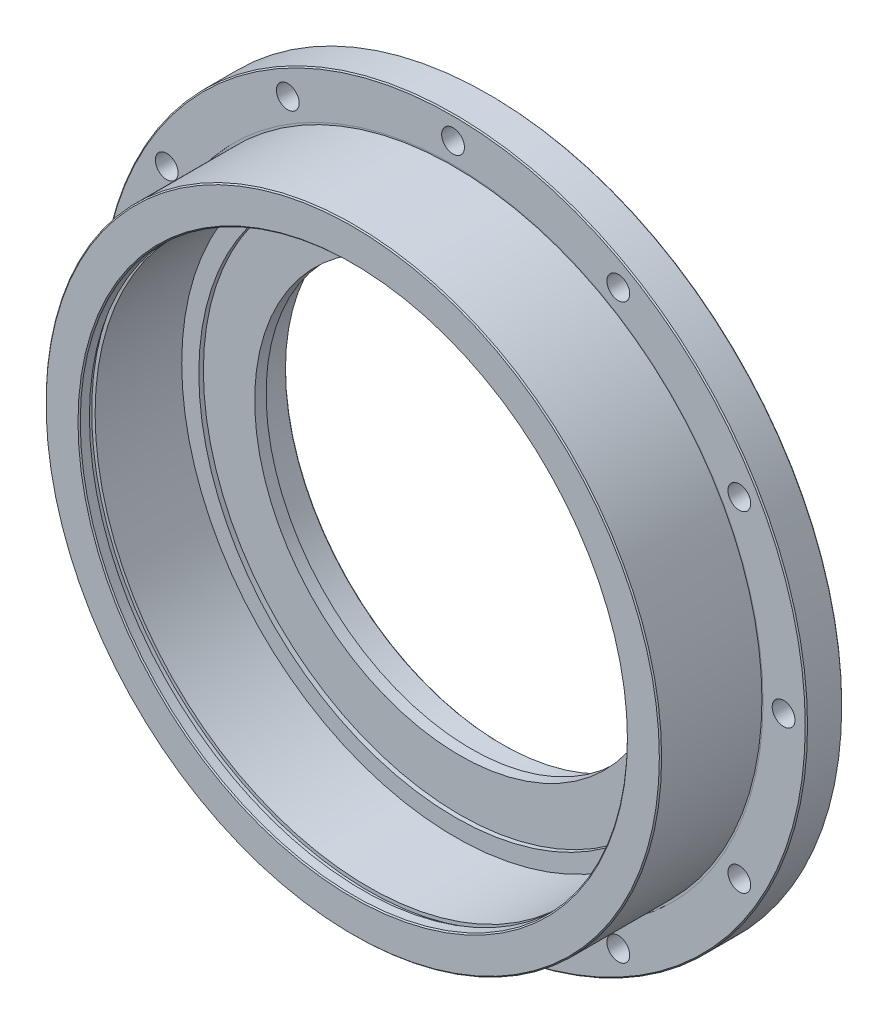
from build123d import *

# Parameters (mm, degrees)
SKETCH_1_R          = 155
EXTRUDE_1_DEPTH     = 20
SKETCH_2_R          = 135
EXTRUDE_2_DEPTH     = 40
SKETCH_3_R          = 120
CUT_EXTRUDE_1_DEPTH = 228.266363547
SKETCH_4_R          = 120
SKETCH_4_R_2        = 112.5
EXTRUDE_3_DEPTH     = 15
SKETCH_5_R          = 121.5
SKETCH_5_R_2        = 120
CUT_EXTRUDE_2_DEPTH = 2.5
SKETCH_7_R          = 5
CUT_EXTRUDE_3_DEPTH = 25
SKETCH_9_R          = 120
CUT_EXTRUDE_4_DEPTH = 13
EXTRUDE_START       = 19
SKETCH_10_R         = 120
SKETCH_10_R_2       = 95
EXTRUDE_4_DEPTH     = 19
EXTRUDE_START_2     = -5
SKETCH_12_R         = 95
SKETCH_12_R_2       = 90
EXTRUDE_5_DEPTH     = 5
CUT_EXTRUDE_START   = -4
SKETCH_13_R         = 155
SKETCH_13_R_2       = 135
CUT_EXTRUDE_5_DEPTH = 4
CHAMFER_1_SIZE      = 0.5
SKETCH_14_W         = 1
SKETCH_14_H         = 0.5


with BuildPart() as part:
    # 草图1 → 拉伸1 (new body)
    with BuildSketch(Plane.XY):
        Circle(SKETCH_1_R)
    extrude(amount=EXTRUDE_1_DEPTH)

    # 草图2 → 拉伸2 (add)
    with BuildSketch(Plane.XY.offset(20)):
        Circle(SKETCH_2_R)
    extrude(amount=EXTRUDE_2_DEPTH)

    # 草图3 → 切除-拉伸1 (cut, through all)
    with BuildSketch(Plane(origin=(0, 0, 0), x_dir=(-1, 0, 0), z_dir=(0, 0, -1))):
        Circle(SKETCH_3_R)
    extrude(amount=-CUT_EXTRUDE_1_DEPTH, mode=Mode.SUBTRACT)

    # 草图4 → 拉伸3 (add)
    with BuildSketch(Plane(origin=(0, 0, 0), x_dir=(-1, 0, 0), z_dir=(0, 0, -1))):
        Circle(SKETCH_4_R)
        Circle(SKETCH_4_R_2, mode=Mode.SUBTRACT)
    extrude(amount=-EXTRUDE_3_DEPTH)

    # 草图5 → 切除-拉伸2 (cut)
    with BuildSketch(Plane.XY.offset(53)):
        Circle(SKETCH_5_R)
        with Locations(Location((0, 0, 0), (0, 0, 180))):
            Circle(SKETCH_5_R_2, mode=Mode.SUBTRACT)
    extrude(amount=CUT_EXTRUDE_2_DEPTH, mode=Mode.SUBTRACT)

    # 草图7 → 切除-拉伸3 (cut)
    with BuildSketch(Plane.XY.offset(20)):
        with Locations((72.5, 125.573683549)):
            Circle(SKETCH_7_R)
        with Locations((0, 145)):
            Circle(SKETCH_7_R)
        with Locations((125.573683549, 72.5)):
            Circle(SKETCH_7_R)
        with Locations((145, 0)):
            Circle(SKETCH_7_R)
        with Locations((125.573683549, -72.5)):
            Circle(SKETCH_7_R)
        with Locations((72.5, -125.573683549)):
            Circle(SKETCH_7_R)
        with Locations((0, -145)):
            Circle(SKETCH_7_R)
        with Locations((-72.5, -125.573683549)):
            Circle(SKETCH_7_R)
        with Locations((-125.573683549, -72.5)):
            Circle(SKETCH_7_R)
        with Locations((-145, 0)):
            Circle(SKETCH_7_R)
        with Locations((-125.573683549, 72.5)):
            Circle(SKETCH_7_R)
        with Locations((-72.5, 125.573683549)):
            Circle(SKETCH_7_R)
    extrude(amount=-CUT_EXTRUDE_3_DEPTH, mode=Mode.SUBTRACT)

    # 草图9 → 切除-拉伸4 (cut)
    with BuildSketch(Plane(origin=(0, 0, 0), x_dir=(-1, 0, 0), z_dir=(0, 0, -1))):
        Circle(SKETCH_9_R)
    extrude(amount=-CUT_EXTRUDE_4_DEPTH, mode=Mode.SUBTRACT)

    # 草图10 → 拉伸4 (add)
    with BuildSketch(Plane(origin=(0, 0, 13), x_dir=(-1, 0, 0), z_dir=(0, 0, -1)).offset(EXTRUDE_START)):
        Circle(SKETCH_10_R)
        Circle(SKETCH_10_R_2, mode=Mode.SUBTRACT)
    extrude(amount=-EXTRUDE_4_DEPTH)

    # 草图12 → 拉伸5 (add)
    with BuildSketch(Plane.XY.offset(13).offset(EXTRUDE_START_2)):
        Circle(SKETCH_12_R)
        Circle(SKETCH_12_R_2, mode=Mode.SUBTRACT)
    extrude(amount=EXTRUDE_5_DEPTH)

    # 草图13 → 切除-拉伸5 (cut)
    with BuildSketch(Plane.XY.offset(20).offset(CUT_EXTRUDE_START)):
        Circle(SKETCH_13_R)
        Circle(SKETCH_13_R_2, mode=Mode.SUBTRACT)
    extrude(amount=CUT_EXTRUDE_5_DEPTH, mode=Mode.SUBTRACT)

    # 倒角1
    chamfer_1_edges = [part.edges().sort_by_distance(p)[0] for p in [
        (120, 0, 60),
        (-155, 0, 16),
        (-155, 0, 0),
        (-135, 0, 60),
        (120, 0, -6),
        (95, 0, -6),
    ]]
    chamfer(chamfer_1_edges, length=CHAMFER_1_SIZE)

    # 草图14 → 切除-旋转1 (revolve, cut)
    with BuildSketch(Plane(origin=(0, 0, 0), x_dir=(1, 0, 0), z_dir=(0, 1, 0)), mode=Mode.PRIVATE) as cut_revolve_1_sk:
        with Locations((-135.5, -15.75)):
            Rectangle(SKETCH_14_W, SKETCH_14_H)
    revolve(cut_revolve_1_sk.sketch.rotate(Axis((0, 0, 8), (0, 0, -1)), 180), axis=Axis((0, 0, 8), (0, 0, -1)), mode=Mode.SUBTRACT)


solid = part.part
